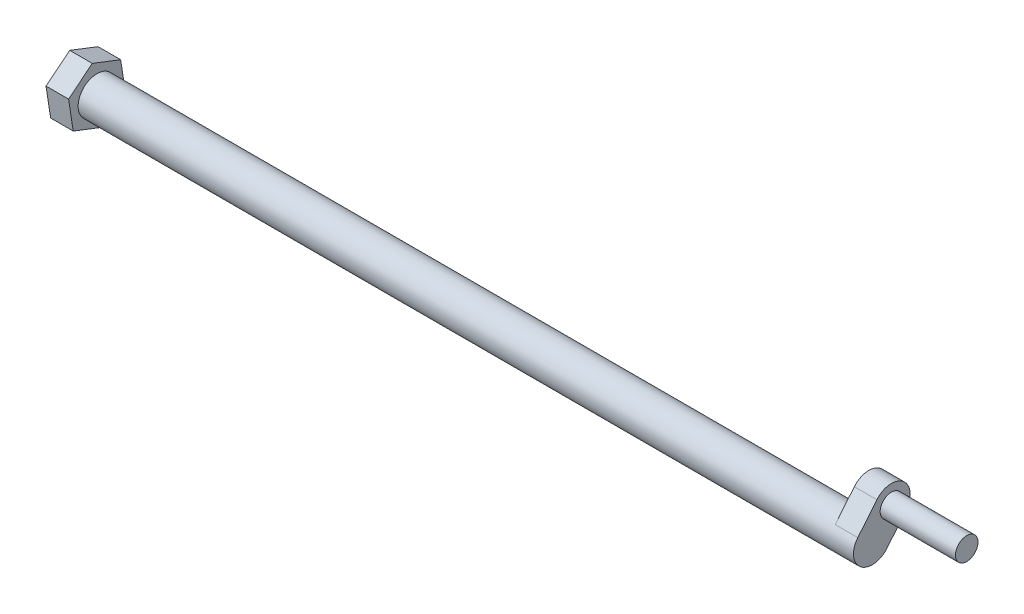
from build123d import *

# Parameters (mm, degrees)
SKETCH_1_R      = 2.5
EXTRUDE_1_DEPTH = 100
EXTRUDE_2_DEPTH = 3
SKETCH_3_R      = 1.5
EXTRUDE_3_DEPTH = 10
EXTRUDE_4_DEPTH = 3


with BuildPart() as part:
    # 草圖1 → 填料-伸長1 (new body)
    with BuildSketch(Plane(origin=(0, 0, 0), x_dir=(0, 0, -1), z_dir=(1, 0, 0))):
        Circle(SKETCH_1_R)
    extrude(amount=EXTRUDE_1_DEPTH)

    # 草圖2 → 填料-伸長2 (add)
    with BuildSketch(Plane(origin=(100, 0, 0), x_dir=(0, 0, -1), z_dir=(1, 0, 0))):
        with BuildLine():
            Line((-1.930937659, 1.587916798), (0.609729217, 4.677417052))
            ThreePointArc((0.609729217, 4.677417052), (4.128583674, 5.020437914), (4.471604535, 1.501583457))
            Line((4.471604535, 1.501583457), (1.930937659, -1.587916798))
            ThreePointArc((1.930937659, -1.587916798), (-1.587916798, -1.930937659), (-1.930937659, 1.587916798))
        make_face()
    extrude(amount=EXTRUDE_2_DEPTH)

    # 草圖3 → 填料-伸長3 (add)
    with BuildSketch(Plane(origin=(103, 0, 0), x_dir=(0, 0, -1), z_dir=(1, 0, 0))):
        with Locations((2.540666876, 3.089500255)):
            Circle(SKETCH_3_R)
    extrude(amount=EXTRUDE_3_DEPTH)

    # 草圖4 → 填料-伸長4 (add)
    with BuildSketch(Plane(origin=(0, 0, 0), x_dir=(0, 0, -1), z_dir=(1, 0, 0))):
        Polygon((-3.149027259, -2.533172054), (0.619277721, -3.993723631), (3.76830498, -1.460551577), (3.149027259, 2.533172054), (-0.619277721, 3.993723631), (-3.76830498, 1.460551577), align=None)
    extrude(amount=-EXTRUDE_4_DEPTH)


solid = part.part
